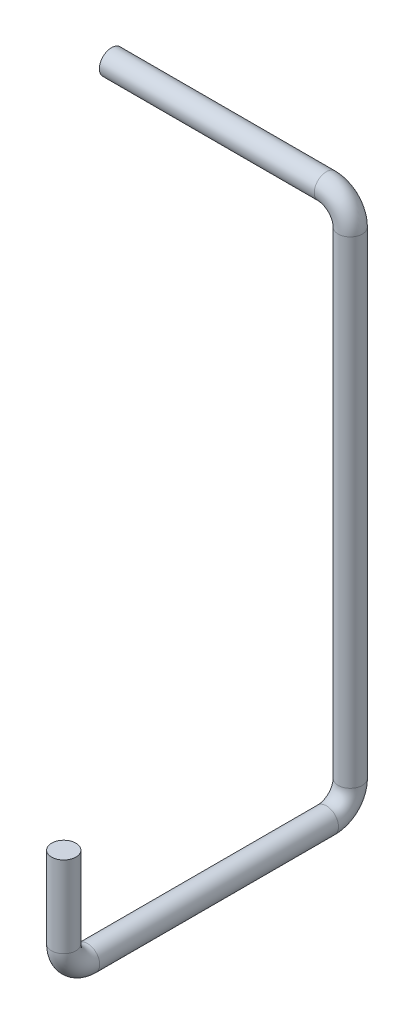
from build123d import *

# Parameters (mm, degrees)
CROQUIS1_R              = 12.7
SALIENTE_EXTRUIR1_DEPTH = 10
CROQUIS2_R              = 12.7


with BuildPart() as part:
    # Croquis1 → Saliente-Extruir1 (new body)
    with BuildSketch(Plane(origin=(0, 0, 0), x_dir=(1, 0, 0), z_dir=(0, 1, 0))):
        with Locations(Location((0, 0, 0), (0, 0, 270))):
            Circle(CROQUIS1_R)
    extrude(amount=-SALIENTE_EXTRUIR1_DEPTH)

    # Barrer1: sweep along a curve in space
    with BuildLine() as barrer1_path:
        Line((0, -10, 0), (0, -85, 0))
        ThreePointArc((0, -85, 0), (0, -102.67766953, -7.32233047), (0, -110, -25))
        Line((0, -110, -25), (0, -110, -275))
        ThreePointArc((0, -110, -275), (0, -102.67766953, -292.67766953), (0, -85, -300))
        Line((0, -85, -300), (0, 415, -300))
        ThreePointArc((0, 415, -300), (-7.32233047, 432.67766953, -300), (-25, 440, -300))
        Line((-25, 440, -300), (-250, 440, -300))
    # Croquis2 → Barrer1 (sweep)
    with BuildSketch(Plane.XZ.offset(10)):
        Circle(CROQUIS2_R)
    sweep(path=barrer1_path.line)


solid = part.part
